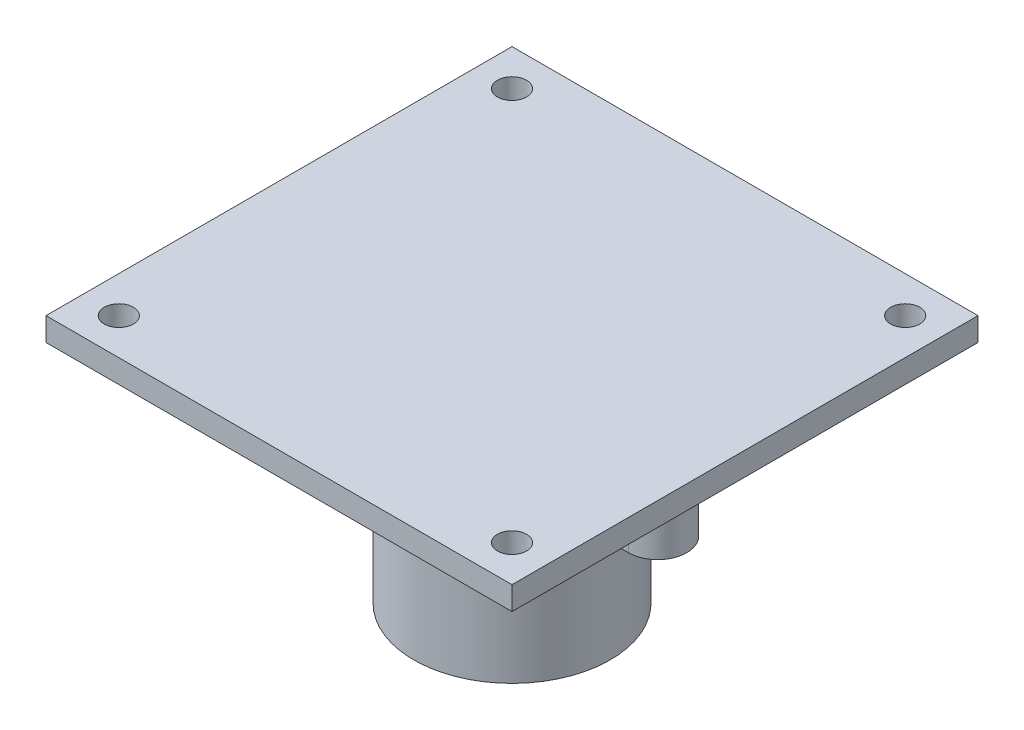
from build123d import *

# Parameters (mm, degrees)
SKETCH_1_W      = 32
SKETCH_1_H      = 32
SKETCH_1_R      = 1
EXTRUDE_1_DEPTH = 1.6
SKETCH_2_W      = 16
SKETCH_2_H      = 16
EXTRUDE_2_DEPTH = 6.5
SKETCH_3_R      = 6.75
EXTRUDE_3_DEPTH = 9


with BuildPart() as part:
    # 草图1 → 凸台-拉伸1 (new body)
    with BuildSketch(Plane(origin=(0, 0, 0), x_dir=(1, 0, 0), z_dir=(0, 1, 0))):
        Rectangle(SKETCH_1_W, SKETCH_1_H)
        with Locations(Location((13.5, 13.5, 0), (0, 0, 270))):
            Circle(SKETCH_1_R, mode=Mode.SUBTRACT)
        with Locations(Location((-13.5, -13.5, 0), (0, 0, 90))):
            Circle(SKETCH_1_R, mode=Mode.SUBTRACT)
        with Locations(Location((-13.5, 13.5, 0), (0, 0, 270))):
            Circle(SKETCH_1_R, mode=Mode.SUBTRACT)
        with Locations(Location((13.5, -13.5, 0), (0, 0, 90))):
            Circle(SKETCH_1_R, mode=Mode.SUBTRACT)
    extrude(amount=EXTRUDE_1_DEPTH)

    # 草图2 → 凸台-拉伸2 (add)
    with BuildSketch(Plane.XZ):
        Rectangle(SKETCH_2_W, SKETCH_2_H)
        with BuildLine():
            Line((-10, -2), (-8, -2))
            Line((-8, -2), (-8, 2))
            Line((-8, 2), (-10, 2))
            ThreePointArc((-10, 2), (-12, 0), (-10, -2))
        make_face()
        with BuildLine():
            Line((8, 2), (8, -2))
            Line((8, -2), (10, -2))
            ThreePointArc((10, -2), (12, 0), (10, 2))
            Line((10, 2), (8, 2))
        make_face()
    extrude(amount=EXTRUDE_2_DEPTH)

    # 草图3 → 凸台-拉伸3 (add)
    with BuildSketch(Plane.XZ.offset(6.5)):
        with Locations(Location((0, 0, 0), (0, 0, 270))):
            Circle(SKETCH_3_R)
    extrude(amount=EXTRUDE_3_DEPTH)


solid = part.part
